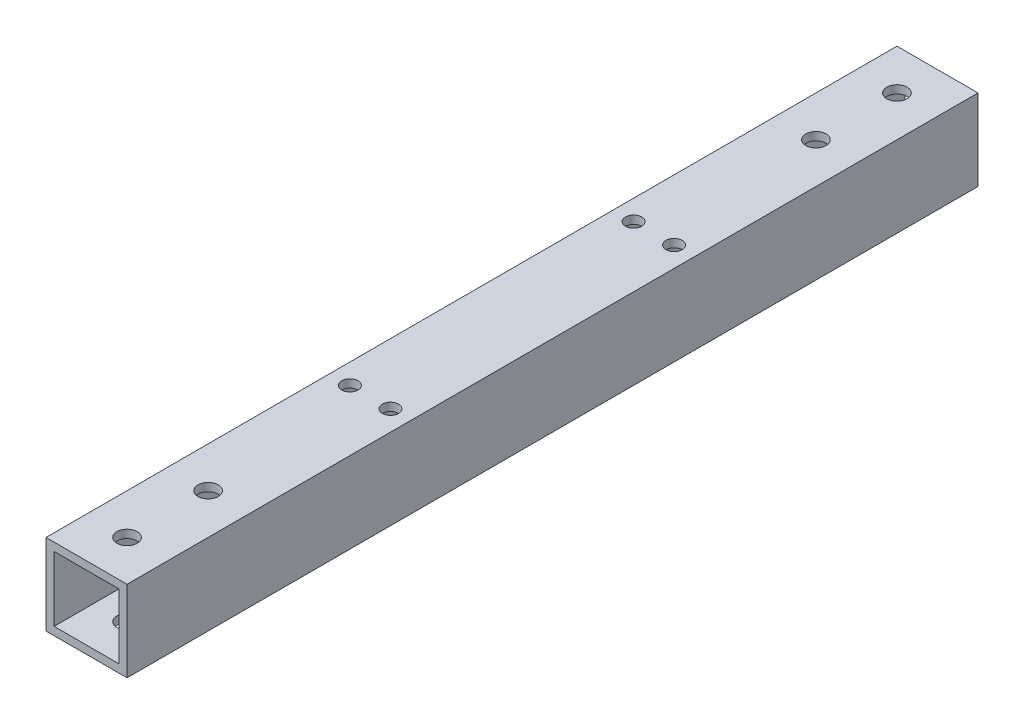
from build123d import *

# Parameters (mm, degrees)
SKETCH1_W           = 20
SKETCH1_H           = 20
SKETCH1_W_2         = 16
SKETCH1_H_2         = 16
BOSS_EXTRUDE1_DEPTH = 210
SKETCH2_R           = 2.5
CUT_EXTRUDE1_DEPTH  = 212.187120819
SKETCH3_R           = 2
CUT_EXTRUDE2_DEPTH  = 212.187120819


with BuildPart() as part:
    # Sketch1 → Boss-Extrude1 (new body)
    with BuildSketch(Plane.XY):
        Rectangle(SKETCH1_W, SKETCH1_H)
        Rectangle(SKETCH1_W_2, SKETCH1_H_2, mode=Mode.SUBTRACT)
    extrude(amount=BOSS_EXTRUDE1_DEPTH)

    # Sketch2 → Cut-Extrude1 (cut, through all)
    with BuildSketch(Plane(origin=(0, 10, 0), x_dir=(1, 0, 0), z_dir=(0, 1, 0))):
        with Locations(Location((0, -10, 0), (0, 0, 270))):
            Circle(SKETCH2_R)
        with Locations(Location((0, -30, 0), (0, 0, 270))):
            Circle(SKETCH2_R)
        with Locations(Location((0, -200, 0), (0, 0, 270))):
            Circle(SKETCH2_R)
        with Locations(Location((0, -180, 0), (0, 0, 270))):
            Circle(SKETCH2_R)
    extrude(amount=-CUT_EXTRUDE1_DEPTH, mode=Mode.SUBTRACT)

    # Sketch3 → Cut-Extrude2 (cut, through all)
    with BuildSketch(Plane(origin=(0, 10, 0), x_dir=(1, 0, 0), z_dir=(0, 1, 0))):
        with Locations(Location((-5, -70, 0), (0, 0, 270))):
            Circle(SKETCH3_R)
        with Locations(Location((5, -70, 0), (0, 0, 270))):
            Circle(SKETCH3_R)
        with Locations(Location((5, -140, 0), (0, 0, 270))):
            Circle(SKETCH3_R)
        with Locations(Location((-5, -140, 0), (0, 0, 270))):
            Circle(SKETCH3_R)
    extrude(amount=-CUT_EXTRUDE2_DEPTH, mode=Mode.SUBTRACT)


solid = part.part
